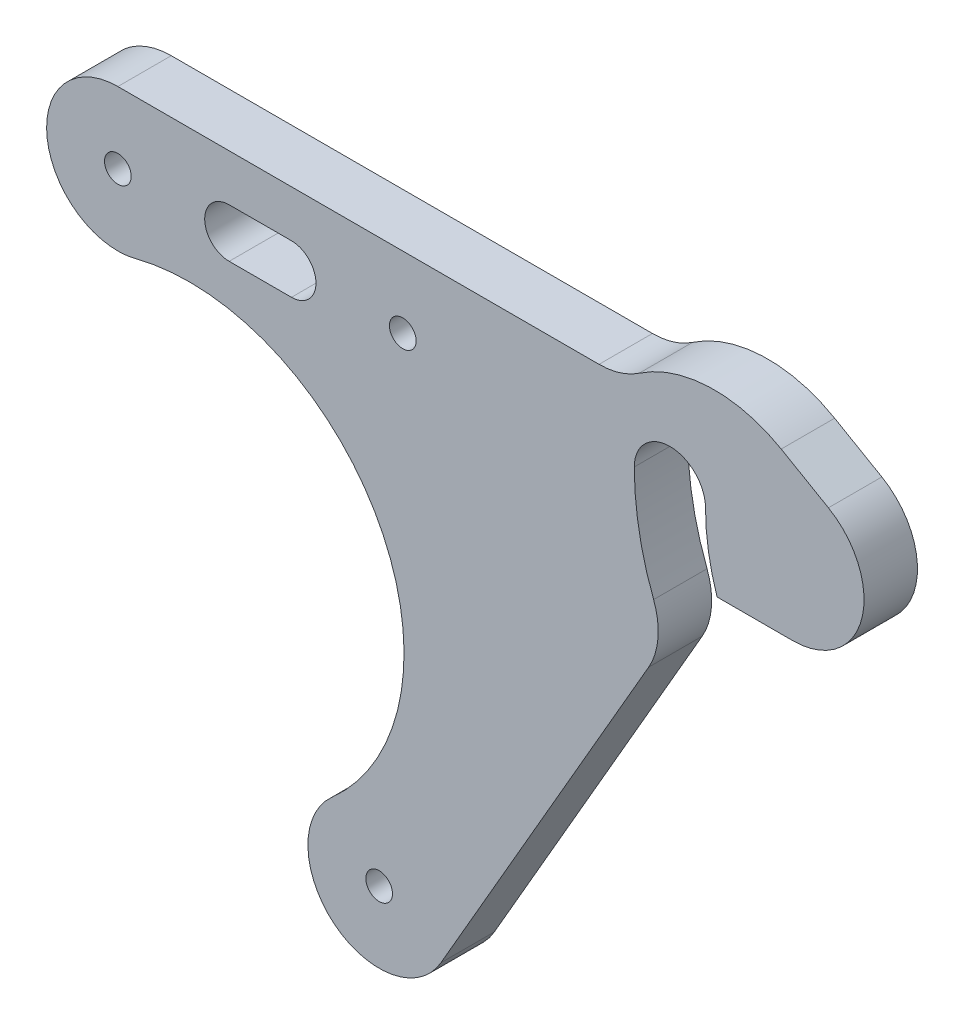
from build123d import *

# Parameters (mm, degrees)
SKETCH1_R           = 1.5
BOSS_EXTRUDE1_DEPTH = 6


with BuildPart() as part:
    # Sketch1 → Boss-Extrude1 (new body)
    # profile 1 of 2: a face of its own
    with BuildSketch(Plane.XY):
        with BuildLine():
            ThreePointArc((4, 0), (4.32733046, -4.052535377), (5.300835088, -8))
            Line((5.300835088, -8), (13.805264562, -8))
            ThreePointArc((13.805264562, -8), (21.532676707, -2.070531706), (17.805227526, 6.928224613))
            Line((17.805227526, 6.928224613), (12.501235753, 9.990447886))
            ThreePointArc((12.501235753, 9.990447886), (4.438362285, 11.989459523), (-3.451860404, 9.391313647))
            ThreePointArc((-3.451860404, 9.391313647), (-9.98812759, -3.562916176), (-2.498625359, -15.990394414))
            Line((-2.498625359, -15.990394414), (-1.533326535, -16.54770307))
            ThreePointArc((-1.533326535, -16.54770307), (-1.322910636, -14.159598792), (-1.82950584, -11.816379171))
            ThreePointArc((-1.82950584, -11.816379171), (-3.45287502, -6.00703466), (-4, 0))
            ThreePointArc((-4, 0), (0, 4), (4, 0))
        make_face()
    # profile 2 of 2: a face of its own
    with BuildSketch(Plane.XY):
        with BuildLine():
            ThreePointArc((-2.498625359, -15.990394414), (-9.98812759, -3.562916176), (-3.451860404, 9.391313647))
            ThreePointArc((-3.451860404, 9.391313647), (-5.601136209, 8.355737746), (-7.960215392, 8))
            Line((-7.960215392, 8), (-62, 8))
            ThreePointArc((-62, 8), (-65.911631869, 6.978476633), (-68.824307899, 4.17478403))
            ThreePointArc((-68.824307899, 4.17478403), (-68.429059963, -4.761007035), (-59.997026703, -7.745198382))
            ThreePointArc((-59.997026703, -7.745198382), (-32.671781582, -19.77866562), (-38.011446212, -49.154869194))
            ThreePointArc((-38.011446212, -49.154869194), (-40.527279582, -53.683744804), (-39.740705478, -58.804431575))
            ThreePointArc((-39.740705478, -58.804431575), (-32.818486758, -63.093194538), (-25.724521947, -59.094912029))
            Line((-25.724521947, -59.094912029), (-2.379078452, -18.659417769))
            ThreePointArc((-2.379078452, -18.659417769), (-1.880761637, -17.633774846), (-1.533326535, -16.54770307))
            Line((-1.533326535, -16.54770307), (-2.498625359, -15.990394414))
        make_face()
        with Locations((-32.652725178, -55.094912029)):
            Circle(SKETCH1_R, mode=Mode.SUBTRACT)
        with Locations((-62, 0)):
            Circle(SKETCH1_R, mode=Mode.SUBTRACT)
        with BuildLine():
            ThreePointArc((-49.5, -2.75), (-52.25, 0), (-49.5, 2.75))
            Line((-49.5, 2.75), (-42.5, 2.75))
            ThreePointArc((-42.5, 2.75), (-39.75, 0), (-42.5, -2.75))
            Line((-42.5, -2.75), (-49.5, -2.75))
        make_face(mode=Mode.SUBTRACT)
        with Locations((-30, 0)):
            Circle(SKETCH1_R, mode=Mode.SUBTRACT)
    extrude(amount=BOSS_EXTRUDE1_DEPTH)


solid = part.part
